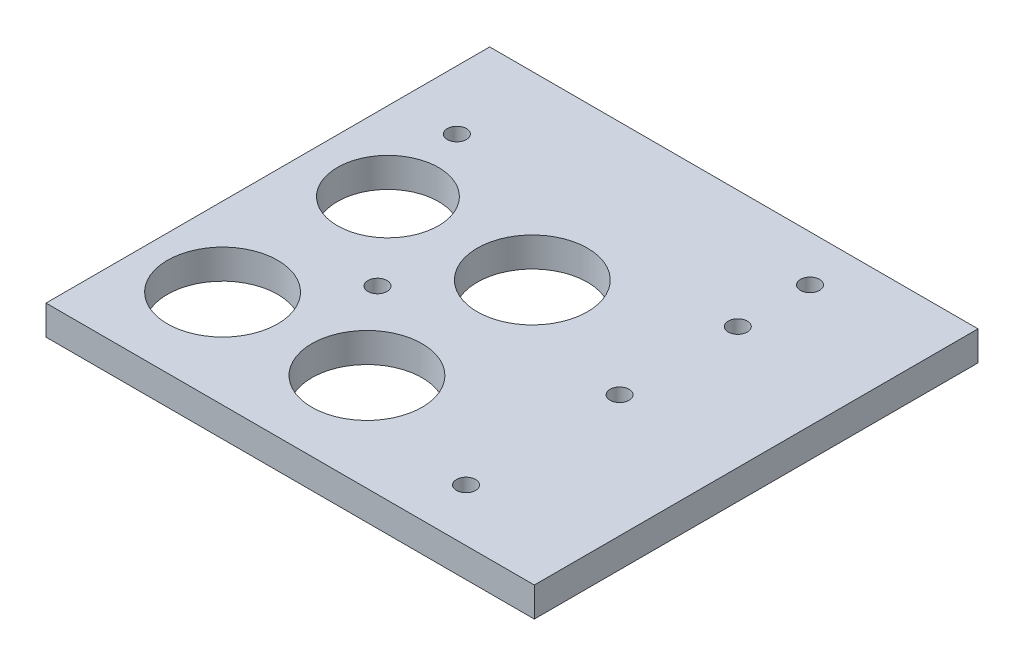
from build123d import *

# Parameters (mm, degrees)
SKETCH1_W                = 94.488
SKETCH1_H                = 85.852
SKETCH1_R                = 9.779
SKETCH1_R_2              = 10.668
BOSS_EXTRUDE1_DEPTH      = 5.715
M3_CLEARANCE_HOLE1_D     = 3.7
M3_CLEARANCE_HOLE1_DEPTH = 25.4
M3_CLEARANCE_HOLE1_TIP   = 1.111592145


with BuildPart() as part:
    # Sketch1 → Boss-Extrude1 (new body)
    with BuildSketch(Plane(origin=(0, 0, 0), x_dir=(1, 0, 0), z_dir=(0, 1, 0))):
        with Locations((18.034, 8.001)):
            Rectangle(SKETCH1_W, SKETCH1_H)
        with Locations(Location((-13.97, 16.002, 0), (0, 0, 270))):
            Circle(SKETCH1_R, mode=Mode.SUBTRACT)
        with Locations(Location((13.97, 16.002, 0), (0, 0, 90))):
            Circle(SKETCH1_R_2, mode=Mode.SUBTRACT)
        with Locations(Location((13.97, -16.002, 0), (0, 0, 270))):
            Circle(SKETCH1_R_2, mode=Mode.SUBTRACT)
        with Locations(Location((-13.97, -16.002, 0), (0, 0, 90))):
            Circle(SKETCH1_R_2, mode=Mode.SUBTRACT)
    extrude(amount=BOSS_EXTRUDE1_DEPTH)

    # M3 Clearance Hole1
    with Locations(Plane(origin=(0, 5.715, 0), x_dir=(1, 0, 0), z_dir=(0, 1, 0))):
        with Locations((41.656, 42.037), (41.91, -24.765), (-17.78, 33.147), (41.656, 5.207), (41.656, 28.067), (0, 0)):
            Hole(M3_CLEARANCE_HOLE1_D / 2, depth=M3_CLEARANCE_HOLE1_DEPTH)
            with Locations((0, 0, -(M3_CLEARANCE_HOLE1_DEPTH + M3_CLEARANCE_HOLE1_TIP / 2))):  # 118° drill point
                Cone(0, M3_CLEARANCE_HOLE1_D / 2, M3_CLEARANCE_HOLE1_TIP, mode=Mode.SUBTRACT)


solid = part.part
